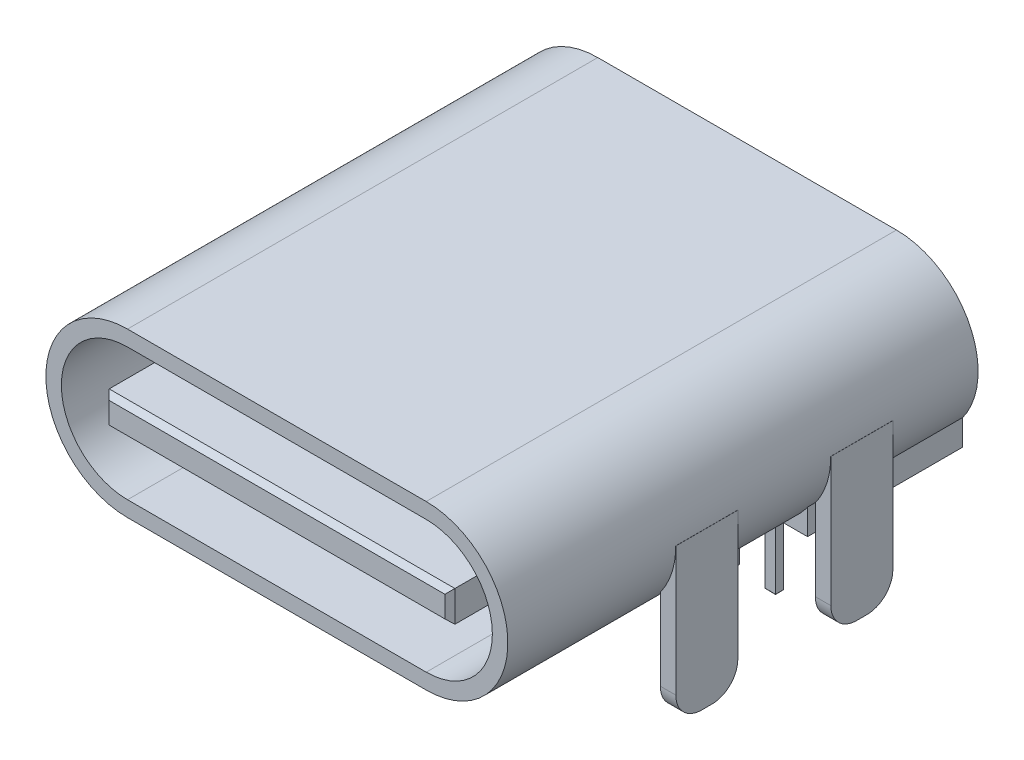
from build123d import *
from OCP.BRepFilletAPI import BRepFilletAPI_MakeChamfer

# Parameters (mm, degrees)
SKETCH1_W             = 6.69
SKETCH1_H             = 0.6
BOSS_EXTRUDE1_DEPTH   = 9.1
BOSS_EXTRUDE1_2_DEPTH = 9.1
CHAMFER1_SIZE         = 0.1
CHAMFER1_SIZE2        = 0.093251509
SKETCH2_W             = 8.34001863
SKETCH2_H             = 3
BOSS_EXTRUDE2_DEPTH   = 2.860018631
FILLET1_R             = 1.25
BOSS_EXTRUDE3_DEPTH   = 0.3
LPATTERN2_COUNT       = 2
LPATTERN2_PITCH       = 3
LPATTERN3_COUNT       = 2
LPATTERN3_PITCH       = 8.64
SKETCH6_W             = 8.34001863
SKETCH6_H             = 3
CUT_EXTRUDE1_DEPTH    = 0.16
SKETCH7_W             = 0.2
SKETCH7_H             = 0.15
BOSS_EXTRUDE4_DEPTH   = 1.8
CHAMFER2_SIZE         = 0.05
CHAMFER2_SIZE2        = 0.046625754
LPATTERN4_COUNT       = 5
LPATTERN4_PITCH       = 0.85
LPATTERN4_2_COUNT     = 4
LPATTERN4_2_PITCH     = 0.85
LPATTERN8_COUNT       = 2
LPATTERN8_PITCH       = 1.35


with BuildPart() as part:
    # Sketch1 → Boss-Extrude1 (new body)
    with BuildSketch(Plane.XY):
        Rectangle(SKETCH1_W, SKETCH1_H)
    extrude(amount=-BOSS_EXTRUDE1_DEPTH)

    # Chamfer1: one chamfer whose edges measure the first distance from different faces: ONE call of the kernel's chamfer builder (chamfer() names one face for all edges)
    chamfer1_edges_1 = [part.edges().sort_by_distance(p)[0] for p in [
        (0, 0.3, 0),
    ]]
    chamfer1_side_1 = [part.faces().sort_by_distance(p)[0] for p in [
        (0, 0.3, -4.55),
    ]]
    chamfer1_edges_2 = [part.edges().sort_by_distance(p)[0] for p in [
        (3.345, 0, 0),
    ]]
    chamfer1_side_2 = [part.faces().sort_by_distance(p)[0] for p in [
        (3.345, 0, -4.55),
    ]]
    chamfer1_edges_3 = [part.edges().sort_by_distance(p)[0] for p in [
        (0, -0.3, 0),
    ]]
    chamfer1_side_3 = [part.faces().sort_by_distance(p)[0] for p in [
        (0, -0.3, -4.55),
    ]]
    chamfer1_edges_4 = [part.edges().sort_by_distance(p)[0] for p in [
        (-3.345, 0, 0),
    ]]
    chamfer1_side_4 = [part.faces().sort_by_distance(p)[0] for p in [
        (-3.345, 0, -4.55),
    ]]
    chamfer1 = BRepFilletAPI_MakeChamfer(part.part.solid().wrapped)
    for e in chamfer1_edges_1:
        chamfer1.Add(CHAMFER1_SIZE, CHAMFER1_SIZE2, e.wrapped, chamfer1_side_1[0].wrapped)  # the first distance lies on this face
    for e in chamfer1_edges_2:
        chamfer1.Add(CHAMFER1_SIZE, CHAMFER1_SIZE2, e.wrapped, chamfer1_side_2[0].wrapped)  # the first distance lies on this face
    for e in chamfer1_edges_3:
        chamfer1.Add(CHAMFER1_SIZE, CHAMFER1_SIZE2, e.wrapped, chamfer1_side_3[0].wrapped)  # the first distance lies on this face
    for e in chamfer1_edges_4:
        chamfer1.Add(CHAMFER1_SIZE, CHAMFER1_SIZE2, e.wrapped, chamfer1_side_4[0].wrapped)  # the first distance lies on this face
    add(Compound.cast(chamfer1.Shape()), mode=Mode.REPLACE)


with BuildPart() as body_2:
    # Sketch1 → Boss-Extrude1 2 (new body)
    with BuildSketch(Plane.XY):
        with BuildLine():
            Line((-2.89, -1.580009315), (2.89, -1.580009315))
            ThreePointArc((2.89, -1.580009315), (4.470009315, 0), (2.89, 1.580009315))
            Line((2.89, 1.580009315), (-2.89, 1.580009315))
            ThreePointArc((-2.89, 1.580009315), (-4.470009315, 0), (-2.89, -1.580009315))
        make_face()
        with BuildLine():
            ThreePointArc((-2.89, 1.280009315), (-4.170009315, 0), (-2.89, -1.280009315))
            Line((-2.89, -1.280009315), (2.89, -1.280009315))
            ThreePointArc((2.89, -1.280009315), (4.170009315, 0), (2.89, 1.280009315))
            Line((2.89, 1.280009315), (-2.89, 1.280009315))
        make_face(mode=Mode.SUBTRACT)
    extrude(amount=-BOSS_EXTRUDE1_2_DEPTH)


with BuildPart() as body_3:
    # Sketch2 → Boss-Extrude2 (new body)
    with BuildSketch(Plane.XZ.offset(1.580009315)):
        with Locations((0, -7.6)):
            Rectangle(SKETCH2_W, SKETCH2_H)
    extrude(amount=-BOSS_EXTRUDE2_DEPTH)

    # Fillet1
    fillet1_edges = [body_3.edges().sort_by_distance(p)[0] for p in [
        (-4.170009315, 1.280009316, -7.6),
        (4.170009315, 1.280009316, -7.6),
    ]]
    fillet(fillet1_edges, radius=FILLET1_R)


with BuildPart() as body_4:
    # Sketch4 → Boss-Extrude3 (new body)
    with BuildSketch(Plane.ZY.offset(4.170009315)):
        with BuildLine():
            Line((-6.75, -3), (-6.95, -3))
            ThreePointArc((-6.95, -3), (-7.303553391, -2.853553391), (-7.45, -2.5))
            Line((-7.45, -2.5), (-7.45, 0))
            Line((-7.45, 0), (-6.25, 0))
            Line((-6.25, 0), (-6.25, -2.5))
            ThreePointArc((-6.25, -2.5), (-6.396446609, -2.853553391), (-6.75, -3))
        make_face()
    boss_extrude3 = extrude(amount=BOSS_EXTRUDE3_DEPTH)


with BuildPart() as lpattern2_1:
    # LPattern2: Boss-Extrude3 ×2
    with Locations(*[(0, 0, i * LPATTERN2_PITCH) for i in range(1, LPATTERN2_COUNT)]):
        add(boss_extrude3)


with BuildPart() as lpattern3_1:
    # LPattern3: pattern copy
    add(lpattern2_1.part.moved(Location(Vector(1, 0, 0) * (1 * LPATTERN3_PITCH))))


with BuildPart() as lpattern3_2:
    # LPattern3: pattern copy
    add(body_4.part.moved(Location(Vector(1, 0, 0) * (1 * LPATTERN3_PITCH))))


with BuildPart() as cut_extrude1_tool:
    # Sketch6 → Cut-Extrude1 (new body)
    with BuildSketch(Plane.XZ.offset(1.580009315)):
        with Locations((0, -7.6)):
            Rectangle(SKETCH6_W, SKETCH6_H)
    extrude(amount=-CUT_EXTRUDE1_DEPTH)


with BuildPart() as body_2_1:
    add(body_2.part)

    # Cut-Extrude1: cut by cut_extrude1_tool
    add(cut_extrude1_tool.part, mode=Mode.SUBTRACT)


with BuildPart() as body_3_1:
    add(body_3.part)

    # Cut-Extrude1: cut by cut_extrude1_tool
    add(cut_extrude1_tool.part, mode=Mode.SUBTRACT)


with BuildPart() as lpattern3_2_1:
    add(lpattern3_2.part)

    # Cut-Extrude1: cut by cut_extrude1_tool
    add(cut_extrude1_tool.part, mode=Mode.SUBTRACT)


with BuildPart() as body_8:
    # Sketch7 → Boss-Extrude4 (new body)
    with BuildSketch(Plane.XZ.offset(1.420009315)):
        with Locations((-0.425, -8)):
            Rectangle(SKETCH7_W, SKETCH7_H)
    extrude(amount=BOSS_EXTRUDE4_DEPTH)

    # Chamfer2: one chamfer whose edges measure the first distance from different faces: ONE call of the kernel's chamfer builder (chamfer() names one face for all edges)
    chamfer2_edges_1 = [body_8.edges().sort_by_distance(p)[0] for p in [
        (-0.325, -3.220009315, -8),
    ]]
    chamfer2_side_1 = [body_8.faces().sort_by_distance(p)[0] for p in [
        (-0.325, -2.320009315, -8),
    ]]
    chamfer2_edges_2 = [body_8.edges().sort_by_distance(p)[0] for p in [
        (-0.425, -3.220009315, -7.925),
    ]]
    chamfer2_side_2 = [body_8.faces().sort_by_distance(p)[0] for p in [
        (-0.425, -2.320009315, -7.925),
    ]]
    chamfer2_edges_3 = [body_8.edges().sort_by_distance(p)[0] for p in [
        (-0.525, -3.220009315, -8),
    ]]
    chamfer2_side_3 = [body_8.faces().sort_by_distance(p)[0] for p in [
        (-0.525, -2.320009315, -8),
    ]]
    chamfer2_edges_4 = [body_8.edges().sort_by_distance(p)[0] for p in [
        (-0.425, -3.220009315, -8.075),
    ]]
    chamfer2_side_4 = [body_8.faces().sort_by_distance(p)[0] for p in [
        (-0.425, -2.320009315, -8.075),
    ]]
    chamfer2 = BRepFilletAPI_MakeChamfer(body_8.part.solid().wrapped)
    for e in chamfer2_edges_1:
        chamfer2.Add(CHAMFER2_SIZE, CHAMFER2_SIZE2, e.wrapped, chamfer2_side_1[0].wrapped)  # the first distance lies on this face
    for e in chamfer2_edges_2:
        chamfer2.Add(CHAMFER2_SIZE, CHAMFER2_SIZE2, e.wrapped, chamfer2_side_2[0].wrapped)  # the first distance lies on this face
    for e in chamfer2_edges_3:
        chamfer2.Add(CHAMFER2_SIZE, CHAMFER2_SIZE2, e.wrapped, chamfer2_side_3[0].wrapped)  # the first distance lies on this face
    for e in chamfer2_edges_4:
        chamfer2.Add(CHAMFER2_SIZE, CHAMFER2_SIZE2, e.wrapped, chamfer2_side_4[0].wrapped)  # the first distance lies on this face
    add(Compound.cast(chamfer2.Shape()), mode=Mode.REPLACE)


with BuildPart() as lpattern4_1:
    # LPattern4: pattern copy
    add(body_8.part.moved(Location(Vector(1, 0, 0) * (1 * LPATTERN4_PITCH))))


with BuildPart() as lpattern4_2:
    # LPattern4: pattern copy
    add(body_8.part.moved(Location(Vector(1, 0, 0) * (2 * LPATTERN4_PITCH))))


with BuildPart() as lpattern4_3:
    # LPattern4: pattern copy
    add(body_8.part.moved(Location(Vector(1, 0, 0) * (3 * LPATTERN4_PITCH))))


with BuildPart() as lpattern4_4:
    # LPattern4: pattern copy
    add(body_8.part.moved(Location(Vector(1, 0, 0) * (4 * LPATTERN4_PITCH))))


with BuildPart() as lpattern4_2_1:
    # LPattern4 2: pattern copy
    add(body_8.part.moved(Location(Vector(-1, 0, 0) * (1 * LPATTERN4_2_PITCH))))


with BuildPart() as lpattern4_2_2:
    # LPattern4 2: pattern copy
    add(body_8.part.moved(Location(Vector(-1, 0, 0) * (2 * LPATTERN4_2_PITCH))))


with BuildPart() as lpattern4_2_3:
    # LPattern4 2: pattern copy
    add(body_8.part.moved(Location(Vector(-1, 0, 0) * (3 * LPATTERN4_2_PITCH))))


with BuildPart() as lpattern8_1:
    # LPattern8: pattern copy
    add(lpattern4_2_3.part.moved(Location(Vector(0, 0, 1) * (1 * LPATTERN8_PITCH))))


with BuildPart() as lpattern8_2:
    # LPattern8: pattern copy
    add(lpattern4_2_2.part.moved(Location(Vector(0, 0, 1) * (1 * LPATTERN8_PITCH))))


with BuildPart() as lpattern8_3:
    # LPattern8: pattern copy
    add(lpattern4_2_1.part.moved(Location(Vector(0, 0, 1) * (1 * LPATTERN8_PITCH))))


with BuildPart() as lpattern8_4:
    # LPattern8: pattern copy
    add(lpattern4_4.part.moved(Location(Vector(0, 0, 1) * (1 * LPATTERN8_PITCH))))


with BuildPart() as lpattern8_5:
    # LPattern8: pattern copy
    add(lpattern4_3.part.moved(Location(Vector(0, 0, 1) * (1 * LPATTERN8_PITCH))))


with BuildPart() as lpattern8_6:
    # LPattern8: pattern copy
    add(lpattern4_2.part.moved(Location(Vector(0, 0, 1) * (1 * LPATTERN8_PITCH))))


with BuildPart() as lpattern8_7:
    # LPattern8: pattern copy
    add(lpattern4_1.part.moved(Location(Vector(0, 0, 1) * (1 * LPATTERN8_PITCH))))


with BuildPart() as lpattern8_8:
    # LPattern8: pattern copy
    add(body_8.part.moved(Location(Vector(0, 0, 1) * (1 * LPATTERN8_PITCH))))


solid = Compound([part.part, body_4.part, lpattern2_1.part, lpattern3_1.part, body_2_1.part, body_3_1.part, lpattern3_2_1.part, body_8.part, lpattern4_1.part, lpattern4_2.part, lpattern4_3.part, lpattern4_4.part, lpattern4_2_1.part, lpattern4_2_2.part, lpattern4_2_3.part, lpattern8_1.part, lpattern8_2.part, lpattern8_3.part, lpattern8_4.part, lpattern8_5.part, lpattern8_6.part, lpattern8_7.part, lpattern8_8.part])
